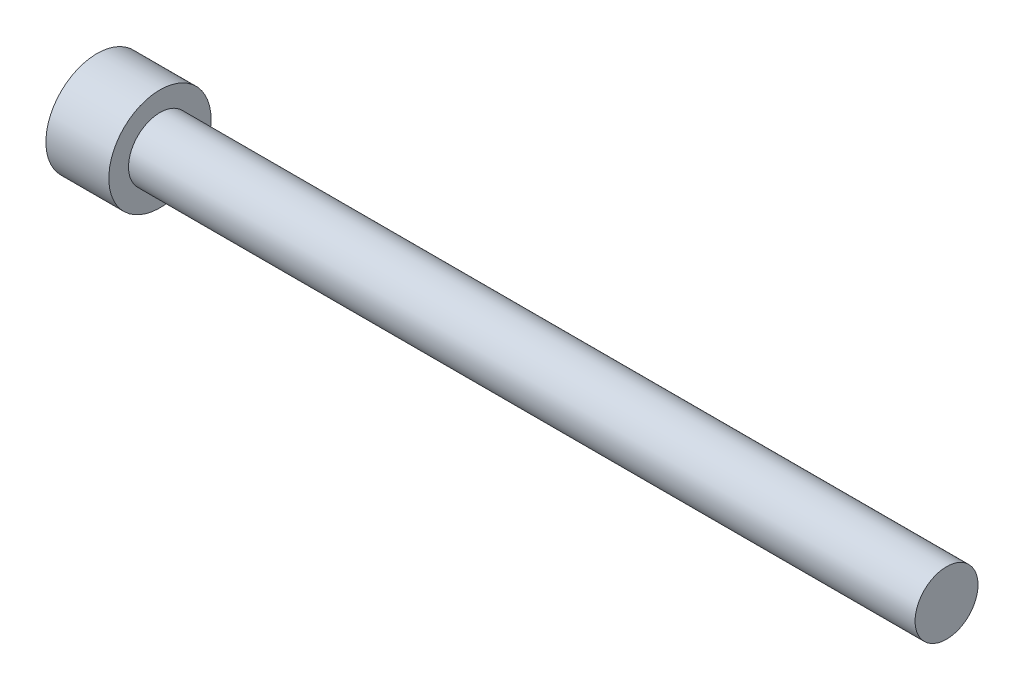
from build123d import *

# Parameters (mm, degrees)
SKETCH1_R           = 6.5
BOSS_EXTRUDE1_DEPTH = 8
CUT_EXTRUDE1_DEPTH  = 4
SKETCH3_R           = 4
BOSS_EXTRUDE2_DEPTH = 100


with BuildPart() as part:
    # Sketch1 → Boss-Extrude1 (new body)
    with BuildSketch(Plane.YZ):
        with Locations(Location((0, 0, 0), (0, 0, 270))):
            Circle(SKETCH1_R)
    extrude(amount=BOSS_EXTRUDE1_DEPTH)

    # Sketch2 → Cut-Extrude1 (cut)
    with BuildSketch(Plane(origin=(0, 0, 0), x_dir=(0, -1, 0), z_dir=(-1, 0, 0))):
        Polygon((3.464101615, 0), (1.732050808, 3), (-1.732050808, 3), (-3.464101615, 0), (-1.732050808, -3), (1.732050808, -3), align=None)
    extrude(amount=-CUT_EXTRUDE1_DEPTH, mode=Mode.SUBTRACT)

    # Sketch3 → Boss-Extrude2 (add)
    with BuildSketch(Plane.YZ.offset(8)):
        with Locations(Location((0, 0, 0), (0, 0, 270))):
            Circle(SKETCH3_R)
    extrude(amount=BOSS_EXTRUDE2_DEPTH)


solid = part.part
